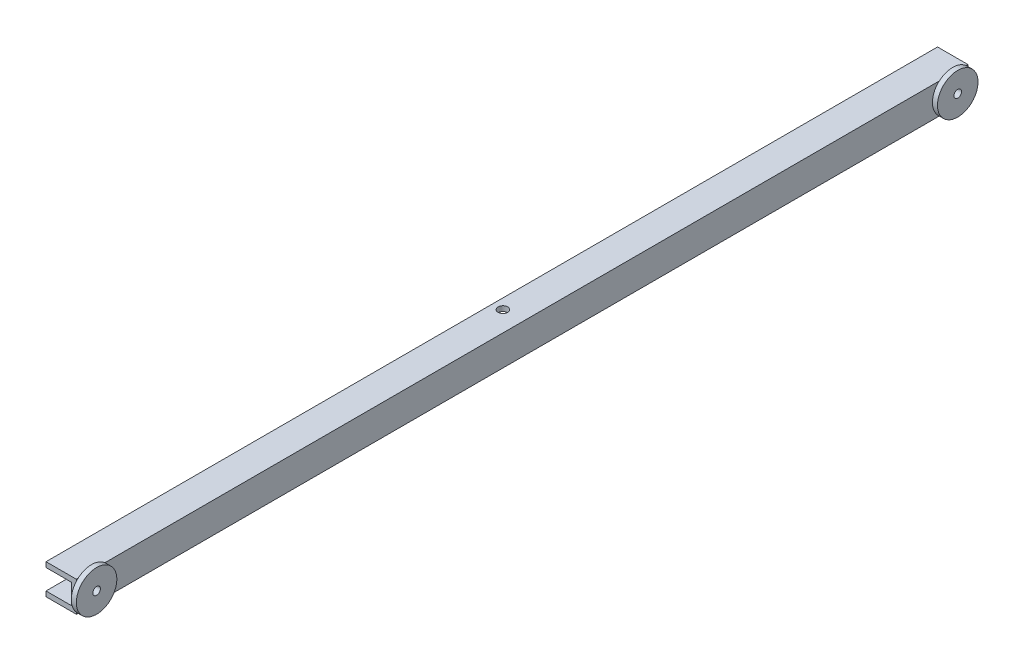
from build123d import *

# Parameters (mm, degrees)
BOSS_EXTRUDE1_DEPTH = 558.8
SKETCH2_R           = 3
CUT_EXTRUDE1_DEPTH  = 558.8
SKETCH4_R           = 2.38125
CUT_EXTRUDE8_DEPTH  = 6.8
BOSS_EXTRUDE3_START = 3.175
SKETCH5_R           = 12.7
SKETCH5_R_2         = 2.38125
BOSS_EXTRUDE3_DEPTH = 3.175


with BuildPart() as part:
    # Sketch1 → Boss-Extrude1 (new body)
    with BuildSketch(Plane.XY):
        Polygon((0, -9.525), (0, 9.525), (-19.01, 9.525), (-19.01, 6.35), (-3.175, 6.35), (-3.175, -6.35), (-19.01, -6.35), (-19.01, -9.525), align=None)
    extrude(amount=-BOSS_EXTRUDE1_DEPTH)

    # Sketch2 → Cut-Extrude1 (cut)
    with BuildSketch(Plane(origin=(0, 9.525, 0), x_dir=(1, 0, 0), z_dir=(0, 1, 0))):
        with Locations(Location((-12.66, 280.013576808, 0), (0, 0, 270))):
            Circle(SKETCH2_R)
    extrude(amount=-CUT_EXTRUDE1_DEPTH, mode=Mode.SUBTRACT)

    # Sketch4 → Cut-Extrude8 (cut)
    with BuildSketch(Plane(origin=(0, 0, 0), x_dir=(0, 0, -1), z_dir=(1, 0, 0))):
        with Locations((9.525, 0)):
            Circle(SKETCH4_R)
        with Locations(Location((549.275, 0, 0), (0, 0, 180))):
            Circle(SKETCH4_R)
    extrude(amount=-CUT_EXTRUDE8_DEPTH, mode=Mode.SUBTRACT)

    # Sketch5 → Boss-Extrude3 (add)
    # profile 1 of 2: a face of its own
    with BuildSketch(Plane(origin=(0, 0, 0), x_dir=(0, 0, -1), z_dir=(1, 0, 0)).offset(BOSS_EXTRUDE3_START)):
        with Locations(Location((9.525, 0, 0), (0, 0, 138.590377891))):
            Circle(SKETCH5_R)
        with Locations((9.525, 0)):
            Circle(SKETCH5_R_2, mode=Mode.SUBTRACT)
    # profile 2 of 2: a face of its own
    with BuildSketch(Plane(origin=(0, 0, 0), x_dir=(0, 0, -1), z_dir=(1, 0, 0)).offset(BOSS_EXTRUDE3_START)):
        with Locations(Location((549.275, 0, 0), (0, 0, 228.590377891))):
            Circle(SKETCH5_R)
        with Locations((549.275, 0)):
            Circle(SKETCH5_R_2, mode=Mode.SUBTRACT)
    extrude(amount=-BOSS_EXTRUDE3_DEPTH)


solid = part.part
